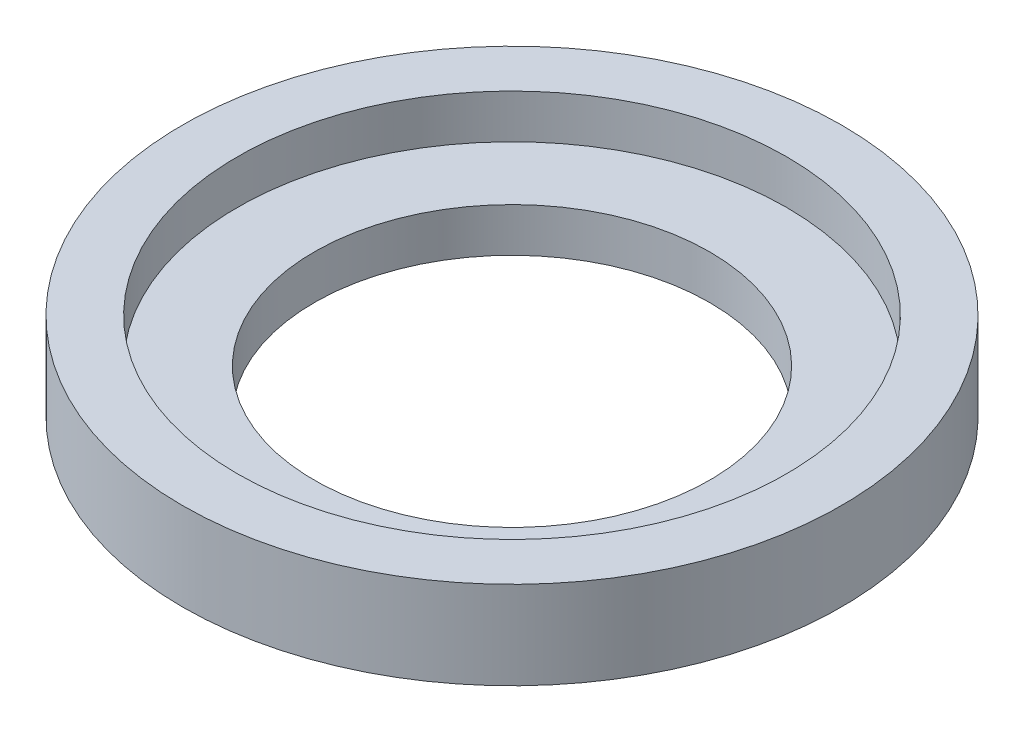
from build123d import *


with BuildPart() as part:
    # Sketch1 → Revolve1 (revolve)
    with BuildSketch(Plane.XY, mode=Mode.PRIVATE) as revolve1_sk:
        Polygon((9, 0), (9, 2), (12.5, 2), (12.5, 4), (15, 4), (15, 0), align=None)
    revolve(revolve1_sk.sketch.rotate(Axis((0, 0, 0), (0, 1, 0)), 90), axis=Axis((0, 0, 0), (0, 1, 0)))


solid = part.part
